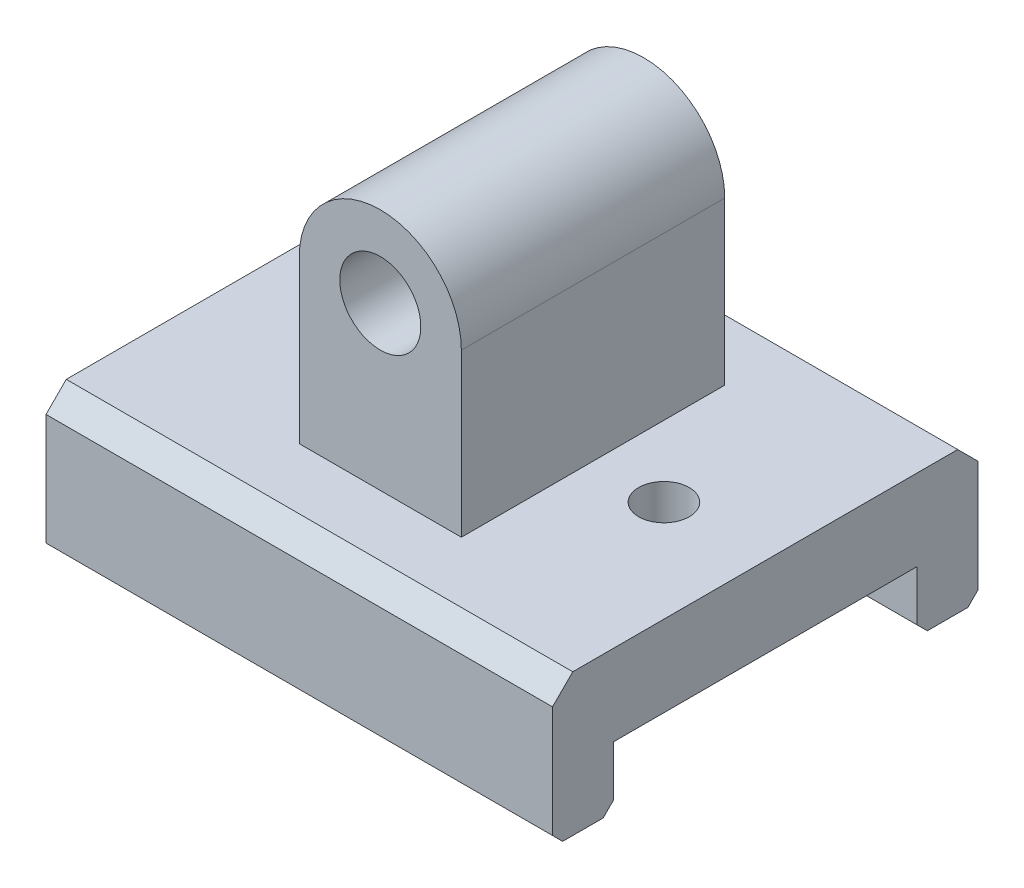
from build123d import *

# Parameters (mm, degrees)
EXTRUDE_1_DEPTH    = 25
SKETCH_2_R         = 2
EXTRUDE_2_DEPTH    = 6.5
HOLE_WIZARD_M3_1_D = 2.5
CHAMFER_1_SIZE     = 1
CHAMFER_2_SIZE     = 0.5


with BuildPart() as part:
    # 草图1 → 凸台-拉伸1 (new body)
    with BuildSketch(Plane(origin=(0, 0, 0), x_dir=(0, 0, -1), z_dir=(1, 0, 0))):
        Polygon((-7.5, 0), (7.5, 0), (7.5, -3), (10.5, -3), (10.5, 4), (-10.5, 4), (-10.5, -3), (-7.5, -3), align=None)
    extrude(amount=EXTRUDE_1_DEPTH)

    # 草图2 → 凸台-拉伸2 (add, symmetric)
    with BuildSketch(Plane.XY):
        with BuildLine():
            Line((8.5, 12), (8.5, 4))
            Line((8.5, 4), (16.5, 4))
            Line((16.5, 4), (16.5, 12))
            ThreePointArc((16.5, 12), (12.5, 16), (8.5, 12))
        make_face()
        with Locations(Location((12.5, 12, 0), (0, 0, 180))):
            Circle(SKETCH_2_R, mode=Mode.SUBTRACT)
    extrude(amount=EXTRUDE_2_DEPTH, both=True)

    # M3 螺纹孔1 (through all)
    with Locations(Plane(origin=(0, 4, 0), x_dir=(1, 0, 0), z_dir=(0, 1, 0))):
        with Locations((5, 0), (20, 0)):
            Hole(HOLE_WIZARD_M3_1_D / 2)

    # 倒角1
    chamfer_1_edges = [part.edges().sort_by_distance(p)[0] for p in [
        (12.5, 4, 10.5),
        (12.5, 4, -10.5),
    ]]
    chamfer(chamfer_1_edges, length=CHAMFER_1_SIZE)

    # 倒角2
    chamfer_2_edges = [part.edges().sort_by_distance(p)[0] for p in [
        (12.5, -3, 7.5),
        (12.5, -3, 10.5),
        (12.5, -3, -10.5),
        (12.5, -3, -7.5),
    ]]
    chamfer(chamfer_2_edges, length=CHAMFER_2_SIZE)


solid = part.part
